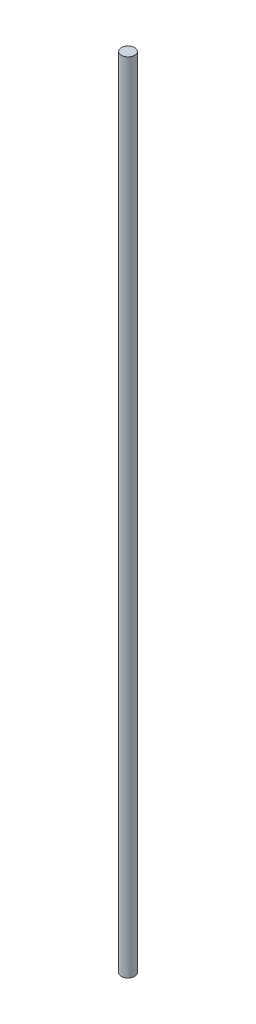
from build123d import *

# Parameters (mm, degrees)
SKETCH1_R           = 3.175
BOSS_EXTRUDE1_DEPTH = 381


with BuildPart() as part:
    # Sketch1 → Boss-Extrude1 (new body)
    with BuildSketch(Plane(origin=(0, 0, 0), x_dir=(1, 0, 0), z_dir=(0, 1, 0))):
        with Locations(Location((0, 0, 0), (0, 0, 270))):
            Circle(SKETCH1_R)
    extrude(amount=BOSS_EXTRUDE1_DEPTH)


solid = part.part
